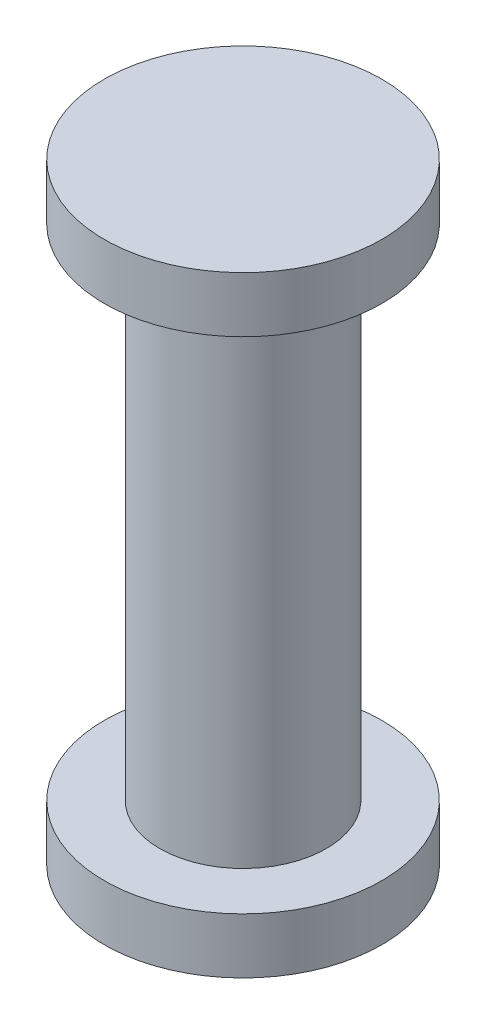
from build123d import *

# Parameters (mm, degrees)
SCALE_1_SCALE = 2.2


with BuildPart() as part:
    # Эскиз1 → Повернуть1 (revolve)
    with BuildSketch(Plane.XY, mode=Mode.PRIVATE) as revolve_1_sk:
        Polygon((0, 0), (0, 11), (-2.5, 11), (-2.5, 10), (-1.5, 10), (-1.5, 1), (-2.5, 1), (-2.5, 0), align=None)
    revolve(revolve_1_sk.sketch.rotate(Axis((0, 0, 0), (0, 1, 0)), 270), axis=Axis((0, 0, 0), (0, 1, 0)))


with BuildPart() as part_1:
    # Масштаб1: scaled about (0, 5.5, 0)
    add(part.part.scale(SCALE_1_SCALE).moved(Location((0, -6.6, 0))))


solid = part_1.part
